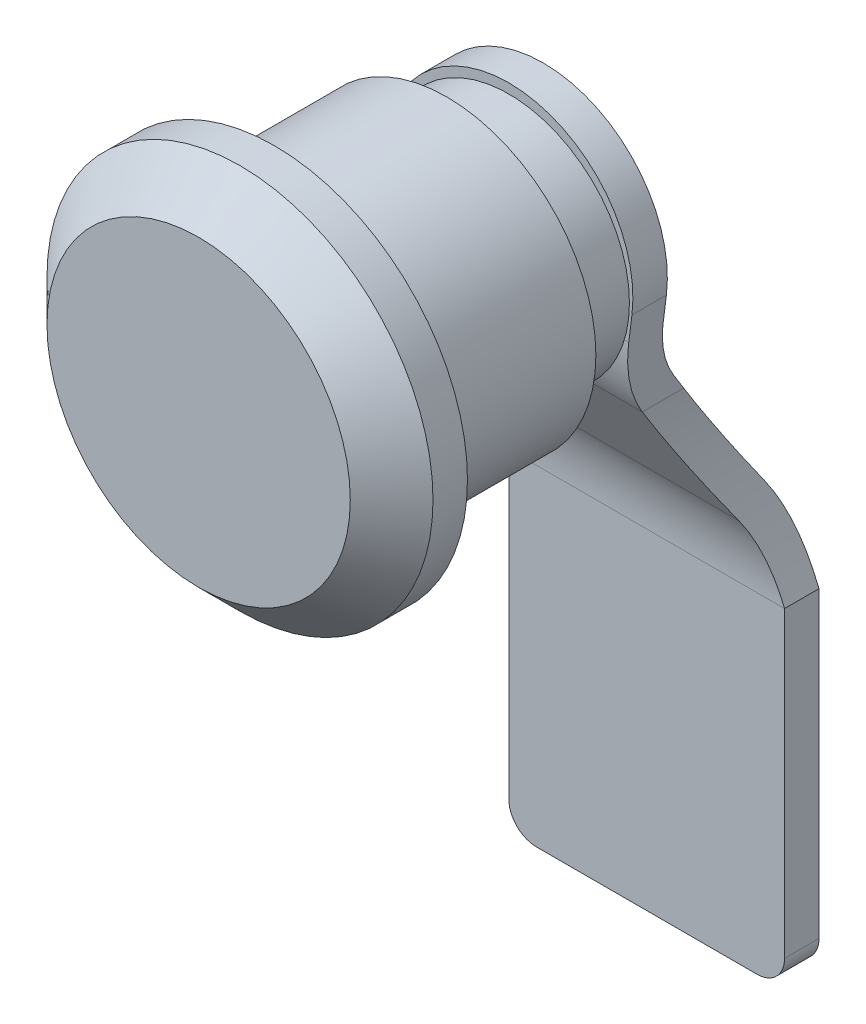
from build123d import *

# Parameters (mm, degrees)
SKETCH6_W           = 20
SKETCH6_H           = 2.5
CUT_EXTRUDE7_DEPTH  = 60.205151803
FILLET1_R           = 2
SKETCH19_W          = 9.5
SKETCH19_H          = 9.5
CUT_EXTRUDE8_DEPTH  = 60.205151841
SKETCH20_R          = 8.75
BOSS_EXTRUDE1_DEPTH = 4.5
SKETCH21_R          = 10.815
BOSS_EXTRUDE2_DEPTH = 12.5
SKETCH22_R          = 14
BOSS_EXTRUDE3_DEPTH = 5.5
CHAMFER1_SIZE       = 3


with BuildPart() as part:
    # Sweep1: sweep along a path in Sketch1
    with BuildLine(Plane.YZ) as sweep1_path:
        Line((0, 0), (23.972243623, 0))
        ThreePointArc((23.972243623, 0), (26.87008511, 0.429079735), (29.519245585, 1.679497057))
        Line((29.519245585, 1.679497057), (39.480754415, 8.320502943))
        ThreePointArc((39.480754415, 8.320502943), (42.12991489, 9.570920265), (45.027756377, 10))
        Line((45.027756377, 10), (57, 10))
    # Sketch6 → Sweep1 (sweep)
    with BuildSketch(Plane(origin=(0, 0, 0), x_dir=(-1, 0, 0), z_dir=(0, 1, 0))):
        with Locations((0, -1.25)):
            Rectangle(SKETCH6_W, SKETCH6_H)
    sweep(path=sweep1_path.line)

    # Sketch18 → Cut-Extrude7 (cut, through all)
    with BuildSketch(Plane.XY.offset(10)):
        with BuildLine():
            Line((10, 57), (0, 57))
            ThreePointArc((0, 57), (6.749137532, 53.953918254), (8.929736256, 46.877587239))
            Line((8.929736256, 46.877587239), (8.697223928, 45.027756377))
            Line((8.697223928, 45.027756377), (10, 45.027756377))
            Line((10, 45.027756377), (10, 57))
        make_face()
        with BuildLine():
            Line((10, 45.027756377), (8.697223928, 45.027756377))
            Line((8.697223928, 45.027756377), (8, 39.480754415))
            ThreePointArc((8, 39.480754415), (8.012671559, 31.599171714), (10, 23.972243623))
            Line((10, 23.972243623), (10, 45.027756377))
        make_face()
        with BuildLine():
            Line((-8.697223928, 45.027756377), (-8.929736256, 46.877587239))
            ThreePointArc((-8.929736256, 46.877587239), (-6.749137532, 53.953918254), (0, 57))
            Line((0, 57), (-10, 57))
            Line((-10, 57), (-10, 45.027756377))
            Line((-10, 45.027756377), (-8.697223928, 45.027756377))
        make_face()
        with BuildLine():
            Line((-8, 39.480754415), (-8.697223928, 45.027756377))
            Line((-8.697223928, 45.027756377), (-10, 45.027756377))
            Line((-10, 45.027756377), (-10, 23.972243623))
            ThreePointArc((-10, 23.972243623), (-8.012671559, 31.599171714), (-8, 39.480754415))
        make_face()
    extrude(amount=-CUT_EXTRUDE7_DEPTH, mode=Mode.SUBTRACT)

    # Fillet1
    fillet1_edges = [part.edges().sort_by_distance(p)[0] for p in [
        (-10, 0, -1.25),
        (10, 0, -1.25),
    ]]
    fillet(fillet1_edges, radius=FILLET1_R)

    # Sketch19 → Cut-Extrude8 (cut, through all)
    with BuildSketch(Plane.XY.offset(10)):
        with Locations((0, 47.55)):
            Rectangle(SKETCH19_W, SKETCH19_H)
    extrude(amount=-CUT_EXTRUDE8_DEPTH, mode=Mode.SUBTRACT)


with BuildPart() as body_2:
    # Sketch20 → Boss-Extrude1 (new body)
    with BuildSketch(Plane.XY.offset(10)):
        with Locations((0, 47.55)):
            Circle(SKETCH20_R)
    extrude(amount=BOSS_EXTRUDE1_DEPTH)

    # Sketch21 → Boss-Extrude2 (add)
    with BuildSketch(Plane(origin=(0, 0, 14.5), x_dir=(0, -1, 0), z_dir=(0, 0, 1))):
        with Locations(Location((-47.55, 0, 0), (0, 0, 90))):
            Circle(SKETCH21_R)
    extrude(amount=BOSS_EXTRUDE2_DEPTH)

    # Sketch22 → Boss-Extrude3 (add)
    with BuildSketch(Plane.XY.offset(27)):
        with Locations((0, 47.55)):
            Circle(SKETCH22_R)
    extrude(amount=BOSS_EXTRUDE3_DEPTH)

    # Chamfer1
    chamfer1_edges = [body_2.edges().sort_by_distance(p)[0] for p in [
        (-14, 47.55, 32.5),
    ]]
    chamfer(chamfer1_edges, length=CHAMFER1_SIZE)


solid = Compound([part.part, body_2.part])
